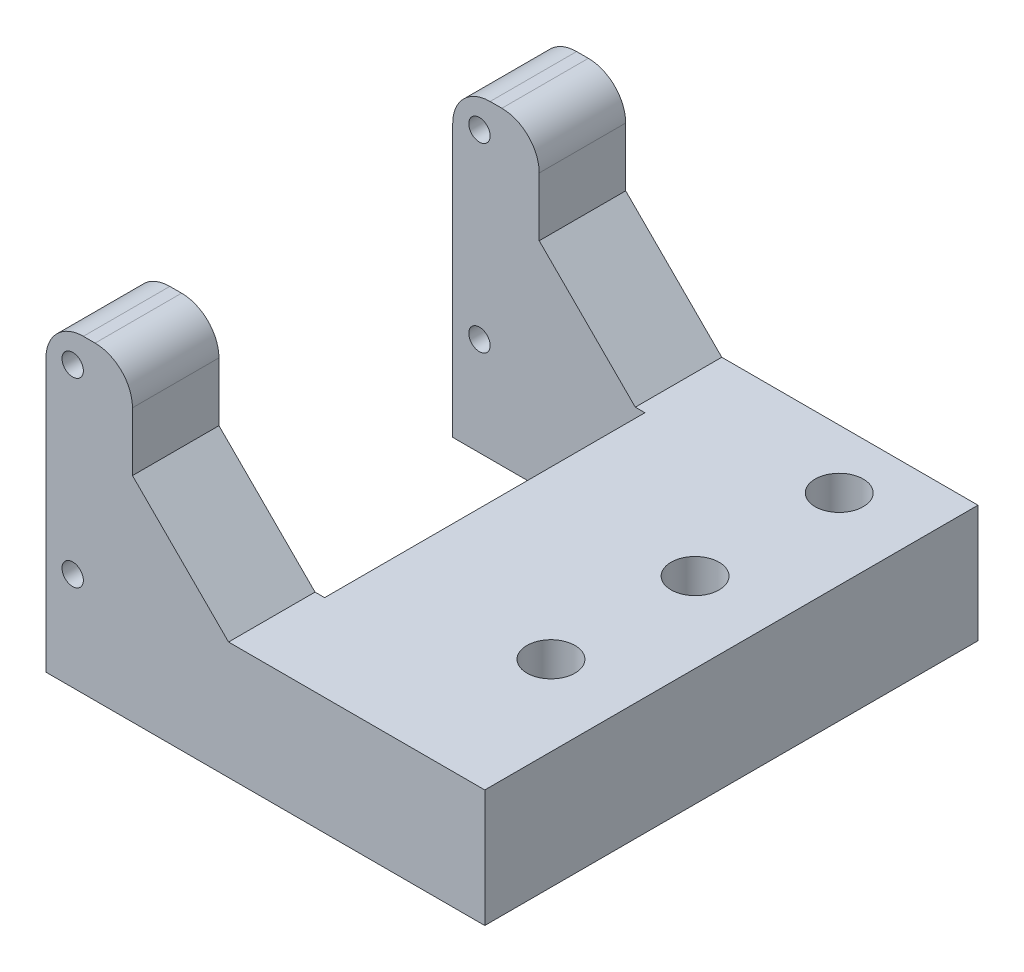
from build123d import *

# Parameters (mm, degrees)
ESQUISSE1_W             = 18
ESQUISSE1_H             = 29
BOSS_EXTRU_1_DEPTH      = 46.2
ESQUISSE3_R             = 1
ENL_V_MAT_EXTRU_1_DEPTH = 58.440752084
ESQUISSE4_W             = 18
ESQUISSE4_H             = 30
ENL_V_MAT_EXTRU_2_DEPTH = 58.440752084
ESQUISSE5_W             = 8.1
ESQUISSE5_H             = 46.2
BOSS_EXTRU_2_DEPTH      = 29
CONG_1_R                = 3.5
ENL_V_START             = -46.2
ESQUISSE7_W             = 18
ESQUISSE7_H             = 18
ENL_V_MAT_EXTRU_4_DEPTH = 46.2
ESQUISSE8_W             = 15
ESQUISSE8_H             = 46.2
ESQUISSE8_R             = 2.25
BOSS_EXTRU_3_DEPTH      = 11
CHANFREIN1_SIZE         = 9
CONG_2_R                = 3.5


with BuildPart() as part:
    # Esquisse1 → Boss.-Extru.1 (new body)
    with BuildSketch(Plane.XY):
        with Locations((9, 14.5)):
            Rectangle(ESQUISSE1_W, ESQUISSE1_H)
    extrude(amount=BOSS_EXTRU_1_DEPTH)

    # Esquisse3 → Enlèv. mat.-Extru.1 (cut, through all)
    with BuildSketch(Plane.XY.offset(46.2)):
        with Locations((2.5, 26.2)):
            Circle(ESQUISSE3_R)
        with Locations((2.5, 9.2)):
            Circle(ESQUISSE3_R)
    extrude(amount=-ENL_V_MAT_EXTRU_1_DEPTH, mode=Mode.SUBTRACT)

    # Esquisse4 → Enlèv. mat.-Extru.2 (cut, through all)
    with BuildSketch(Plane(origin=(0, 29, 0), x_dir=(1, 0, 0), z_dir=(0, 1, 0))):
        with Locations((9, -23.1)):
            Rectangle(ESQUISSE4_W, ESQUISSE4_H)
    extrude(amount=-ENL_V_MAT_EXTRU_2_DEPTH, mode=Mode.SUBTRACT)


with BuildPart() as enl_v_mat_extru_2_piece_1:
    # of the separate pieces the step leaves, piece 1, a body of its own (enl_v_mat_extru_2_pieces)
    add(part.part.solids().sort_by_distance((0, 0, 0))[0])



with BuildPart() as enl_v_mat_extru_2_piece_2:
    # of the separate pieces the step leaves, piece 2, a body of its own (enl_v_mat_extru_2_pieces)
    add(part.part.solids().sort_by_distance((18, 0, 38.1))[0])


with BuildPart() as enl_v_mat_extru_2_piece_1_1:
    add(enl_v_mat_extru_2_piece_1.part)

    add(enl_v_mat_extru_2_piece_2.part)  # Boss.-Extru.2 merges Enlèv. mat.-Extru.2 piece 2
    # Esquisse5 → Boss.-Extru.2 (add)
    with BuildSketch(Plane(origin=(0, 29, 0), x_dir=(1, 0, 0), z_dir=(0, 1, 0))):
        with Locations((22.05, -23.1)):
            Rectangle(ESQUISSE5_W, ESQUISSE5_H)
    extrude(amount=-BOSS_EXTRU_2_DEPTH)

    # Congé1
    cong_1_edges = [enl_v_mat_extru_2_piece_1_1.edges().sort_by_distance(p)[0] for p in [
        (0, 29, 42.15),
        (0, 29, 4.05),
    ]]
    fillet(cong_1_edges, radius=CONG_1_R)

    # Esquisse7 → Enlèv. mat.-Extru.4 (cut)
    with BuildSketch(Plane(origin=(0, 0, 0), x_dir=(-1, 0, 0), z_dir=(0, 0, -1)).offset(ENL_V_START)):
        with Locations((-17.1, 20)):
            Rectangle(ESQUISSE7_W, ESQUISSE7_H)
    extrude(amount=ENL_V_MAT_EXTRU_4_DEPTH, mode=Mode.SUBTRACT)

    # Esquisse8 → Boss.-Extru.3 (add)
    with BuildSketch(Plane(origin=(0, 11, 0), x_dir=(1, 0, 0), z_dir=(0, 1, 0))):
        with Locations((33.6, -23.1)):
            Rectangle(ESQUISSE8_W, ESQUISSE8_H)
        with Locations(Location((33.6, -5.5, 0), (0, 0, 270))):
            Circle(ESQUISSE8_R, mode=Mode.SUBTRACT)
        with Locations(Location((33.6, -32.5, 0), (0, 0, 270))):
            Circle(ESQUISSE8_R, mode=Mode.SUBTRACT)
        with Locations(Location((33.6, -19, 0), (0, 0, 270))):
            Circle(ESQUISSE8_R, mode=Mode.SUBTRACT)
    extrude(amount=-BOSS_EXTRU_3_DEPTH)

    # Chanfrein1
    chanfrein1_edges = [enl_v_mat_extru_2_piece_1_1.edges().sort_by_distance(p)[0] for p in [
        (8.1, 11, 42.15),
        (8.1, 11, 4.05),
    ]]
    chamfer(chanfrein1_edges, length=CHANFREIN1_SIZE)

    # Congé2
    cong_2_edges = [enl_v_mat_extru_2_piece_1_1.edges().sort_by_distance(p)[0] for p in [
        (8.1, 29, 42.15),
        (8.1, 29, 4.05),
    ]]
    fillet(cong_2_edges, radius=CONG_2_R)


solid = enl_v_mat_extru_2_piece_1_1.part
